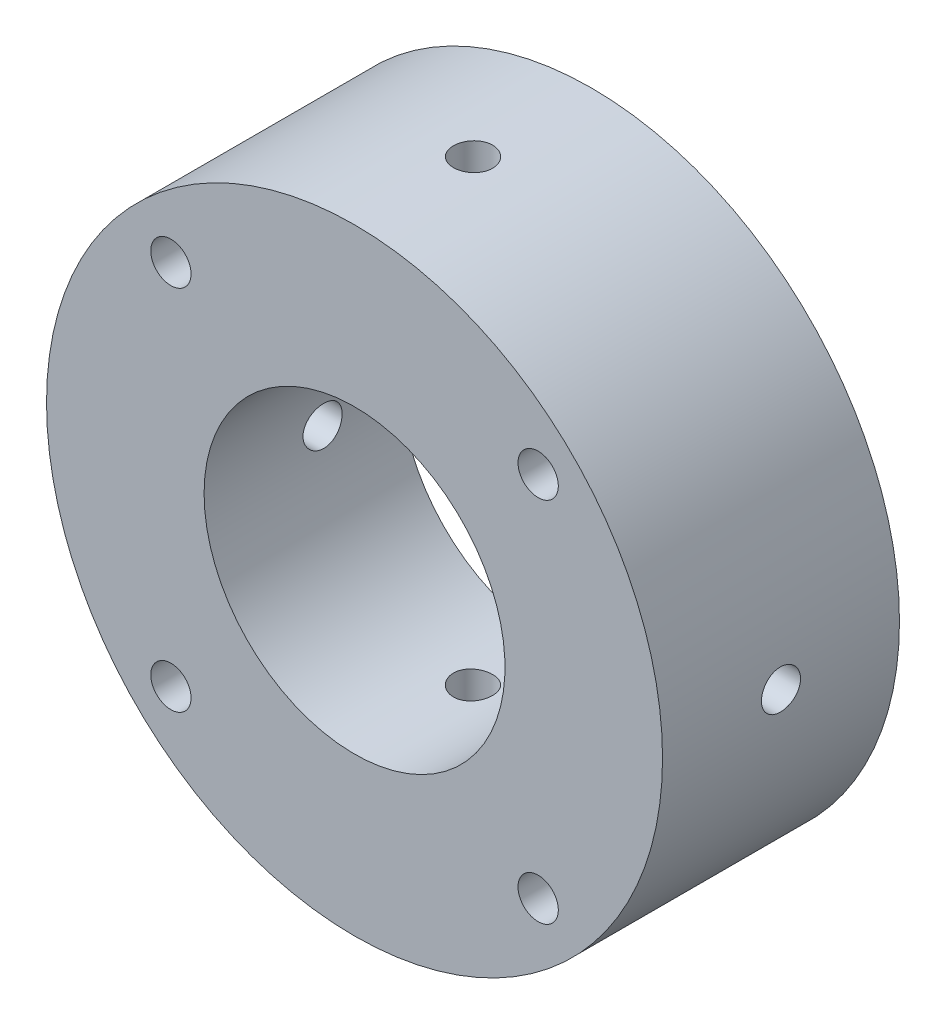
from build123d import *

# Parameters (mm, degrees)
SKETCH1_W                                           = 26
SKETCH1_H                                           = 20
F_2_CLEARANCE_HOLE1_D                               = 2.5
F_2_CLEARANCE_HOLE1_DEPTH                           = 6
HOLE1_D                                             = 25.4
HOLE1_CBORE_D                                       = 40
HOLE1_CBORE_DEPTH                                   = 3.4
F_4_CLEARANCE_HOLE1_D                               = 3.3
F_4_CLEARANCE_HOLE1_DEPTH                           = 65.407641206
F_4_CLEARANCE_HOLE2_D                               = 3.3
F_4_CLEARANCE_HOLE2_DEPTH                           = 13.407641206
F_4_CLEARANCE_HOLE3_D                               = 3.3
CBORE_FOR_4_BINDING_HEAD_MACHINE_SCREW1_D           = 3.4
CBORE_FOR_4_BINDING_HEAD_MACHINE_SCREW1_CBORE_D     = 6.5
CBORE_FOR_4_BINDING_HEAD_MACHINE_SCREW1_CBORE_DEPTH = 7.5


with BuildPart() as part:
    # Sketch1 → Revolve1 (revolve)
    with BuildSketch(Plane.XZ, mode=Mode.PRIVATE) as revolve1_sk:
        with Locations((13, 10)):
            Rectangle(SKETCH1_W, SKETCH1_H)
    revolve(revolve1_sk.sketch.rotate(Axis((0, 0, 20), (0, 0, -1)), 180), axis=Axis((0, 0, 20), (0, 0, -1)))

    # #2 Clearance Hole1
    with Locations(Plane(origin=(0, 0, 0), x_dir=(-1, 0, 0), z_dir=(0, 0, -1))):
        with Locations((-22.776165581, 3.200981322)):
            Hole(F_2_CLEARANCE_HOLE1_D / 2, depth=F_2_CLEARANCE_HOLE1_DEPTH)

    # Hole1 (through all)
    with Locations(Plane(origin=(0, 0, 0), x_dir=(-1, 0, 0), z_dir=(0, 0, -1))):
        with Locations((0, 0)):
            CounterBoreHole(HOLE1_D / 2, HOLE1_CBORE_D / 2, HOLE1_CBORE_DEPTH)

    # #4 Clearance Hole1
    with Locations(Plane(origin=(26, 0, 10), x_dir=(0, 1, 0), z_dir=(1, 0, 0))):
        with Locations((0, 0)):
            Hole(F_4_CLEARANCE_HOLE1_D / 2, depth=F_4_CLEARANCE_HOLE1_DEPTH)

    # #4 Clearance Hole2
    with Locations(Plane(origin=(0, 12.592358794, 0), x_dir=(-1, 0, 0), z_dir=(0, -1, 0))):
        with Locations((0, -10)):
            Hole(F_4_CLEARANCE_HOLE2_D / 2, depth=F_4_CLEARANCE_HOLE2_DEPTH)

    # #4 Clearance Hole3 (through all)
    with Locations(Plane(origin=(0, -12.592358794, 0), x_dir=(1, 0, 0), z_dir=(0, 1, 0))):
        with Locations((0, -10)):
            Hole(F_4_CLEARANCE_HOLE3_D / 2)

    # CBORE for #4 Binding Head Machine Screw1 (through all)
    with Locations(Plane(origin=(0, 0, 0), x_dir=(-1, 0, 0), z_dir=(0, 0, -1))):
        with Locations((-15.5, -15.5), (15.5, -15.5), (15.5, 15.5), (-15.5, 15.5)):
            CounterBoreHole(CBORE_FOR_4_BINDING_HEAD_MACHINE_SCREW1_D / 2, CBORE_FOR_4_BINDING_HEAD_MACHINE_SCREW1_CBORE_D / 2, CBORE_FOR_4_BINDING_HEAD_MACHINE_SCREW1_CBORE_DEPTH)


solid = part.part
